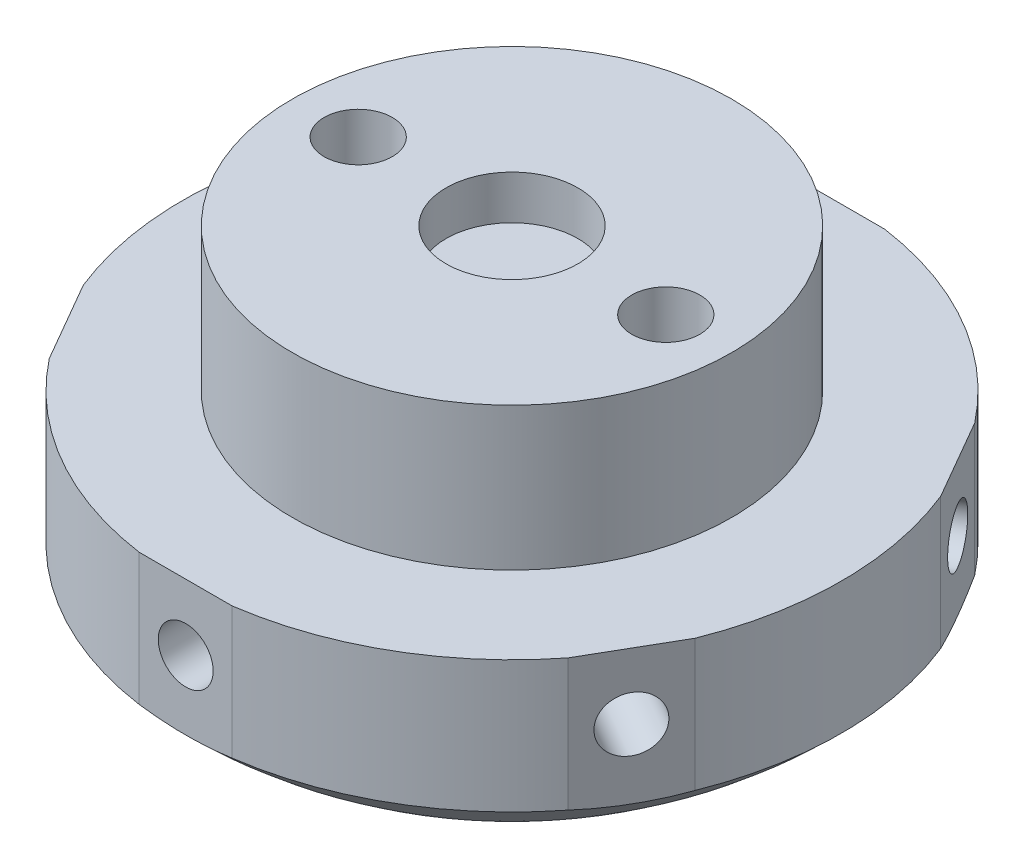
from build123d import *

# Parameters (mm, degrees)
SKETCH_1_R               = 15
EXTRUDE_1_DEPTH          = 6
SKETCH_2_R               = 10
EXTRUDE_2_DEPTH          = 6.5
SKETCH_5_R               = 1.55
CUT_EXTRUDE_967_DEPTH    = 29.287523448
SKETCH_6_R               = 2.5
CUT_EXTRUDE_1129_DEPTH   = 3.7
CUT_EXTRUDE_3_DEPTH      = 25.477792773
PATTERN_CIRCULAR_1_COUNT = 6
SKETCH_12_R              = 3
CUT_EXTRUDE_4_DEPTH      = 2


with BuildPart() as part:
    # 草图1 → 凸台-拉伸1 (new body)
    with BuildSketch(Plane(origin=(0, 0, 0), x_dir=(1, 0, 0), z_dir=(0, 1, 0))):
        with Locations(Location((0, 0, 0), (0, 0, 270))):
            Circle(SKETCH_1_R)
    extrude(amount=EXTRUDE_1_DEPTH)

    # 草图2 → 凸台-拉伸2 (add)
    with BuildSketch(Plane(origin=(0, 6, 0), x_dir=(1, 0, 0), z_dir=(0, 1, 0))):
        with Locations(Location((0, 0, 0), (0, 0, 90))):
            Circle(SKETCH_2_R)
    extrude(amount=EXTRUDE_2_DEPTH)

    # 草图4 → 旋转1 (revolve)
    with BuildSketch(Plane.XY, mode=Mode.PRIVATE) as revolve_1_sk:
        with BuildLine():
            Line((0, 0), (0, -6.213203436))
            ThreePointArc((0, -6.213203436), (8.117941502, -4.598444473), (15, 0))
            Line((15, 0), (0, 0))
        make_face()
    revolve(revolve_1_sk.sketch.rotate(Axis((0, 0, 0), (0, -1, 0)), 180), axis=Axis((0, 0, 0), (0, -1, 0)))

    # 草图5 → Cut-Extrude 967 (cut, through all)
    with BuildSketch(Plane(origin=(0, 12.5, 0), x_dir=(1, 0, 0), z_dir=(0, 1, 0))):
        with Locations(Location((7, 0, 0), (0, 0, 270))):
            Circle(SKETCH_5_R)
        with Locations(Location((-7, 0, 0), (0, 0, 270))):
            Circle(SKETCH_5_R)
    extrude(amount=-CUT_EXTRUDE_967_DEPTH, mode=Mode.SUBTRACT)

    # 草图6 → Cut-Extrude 1129 (cut)
    with BuildSketch(Plane(origin=(0, -6.2, 0), x_dir=(1, 0, 0), z_dir=(0, 1, 0))):
        with Locations(Location((-7, 0, 0), (0, 0, 129.482318069))):
            Circle(SKETCH_6_R)
        with Locations(Location((7, 0, 0), (0, 0, 133.910612472))):
            Circle(SKETCH_6_R)
    extrude(amount=CUT_EXTRUDE_1129_DEPTH, mode=Mode.SUBTRACT)

    # 草图9 → 切除-拉伸3 (cut, through all)
    with BuildSketch(Plane(origin=(0, 6, 0), x_dir=(1, 0, 0), z_dir=(0, 1, 0))):
        with BuildLine():
            Line((11.802472048, 9.257518758), (13.918482445, 5.592481242))
            ThreePointArc((13.918482445, 5.592481242), (12.990381057, 7.5), (11.802472048, 9.257518758))
        make_face()
        with BuildLine():
            Line((-2.116010397, 14.85), (2.116010397, 14.85))
            ThreePointArc((2.116010397, 14.85), (0, 15), (-2.116010397, 14.85))
        make_face()
        with BuildLine():
            Line((13.918482445, -5.592481242), (11.802472048, -9.257518758))
            ThreePointArc((11.802472048, -9.257518758), (12.990381057, -7.5), (13.918482445, -5.592481242))
        make_face()
        with BuildLine():
            Line((2.116010397, -14.85), (-2.116010397, -14.85))
            ThreePointArc((-2.116010397, -14.85), (0, -15), (2.116010397, -14.85))
        make_face()
        with BuildLine():
            Line((-11.802472048, -9.257518758), (-13.918482445, -5.592481242))
            ThreePointArc((-13.918482445, -5.592481242), (-12.990381057, -7.5), (-11.802472048, -9.257518758))
        make_face()
        with BuildLine():
            Line((-13.918482445, 5.592481242), (-11.802472048, 9.257518758))
            ThreePointArc((-11.802472048, 9.257518758), (-12.990381057, 7.5), (-13.918482445, 5.592481242))
        make_face()
    extrude(amount=-CUT_EXTRUDE_3_DEPTH, mode=Mode.SUBTRACT)

    # 草图11 → M3 螺纹孔2 (revolve, cut)
    with BuildSketch(Plane(origin=(-12.860477246, 3, -7.425), x_dir=(-0.50000000000004, 0, 0.8660254037844157), z_dir=(0, 1, 0))):
        Polygon((0, 0), (0, 8.751075774), (1.25, 8), (1.25, 0), align=None)
    hole_wizard_m3_2 = revolve(axis=Axis((-18.35973856, 3, -10.6), (0.8660254037844156, 0, 0.5000000000000397)), mode=Mode.SUBTRACT)

    # 阵列(圆周)1: M3 螺纹孔2 ×6 about axis
    pattern_circular_1_axis = Axis((0, 6, 0), (0, 1, 0))
    for i in range(1, PATTERN_CIRCULAR_1_COUNT):
        add(hole_wizard_m3_2.rotate(pattern_circular_1_axis, i * 360 / PATTERN_CIRCULAR_1_COUNT), mode=Mode.SUBTRACT)

    # 草图12 → 切除-拉伸4 (cut)
    with BuildSketch(Plane(origin=(0, 12.5, 0), x_dir=(1, 0, 0), z_dir=(0, 1, 0))):
        with Locations(Location((0, 0, 0), (0, 0, 270))):
            Circle(SKETCH_12_R)
    extrude(amount=-CUT_EXTRUDE_4_DEPTH, mode=Mode.SUBTRACT)


solid = part.part
